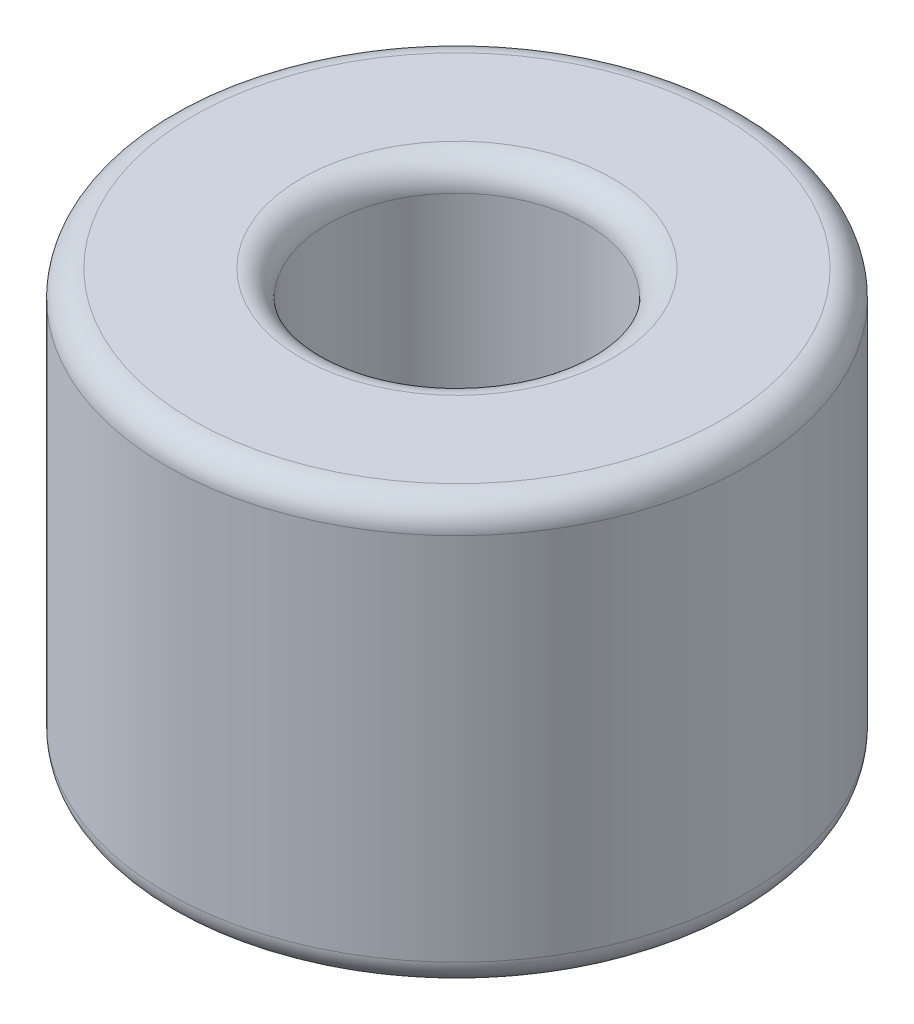
from build123d import *

# Parameters (mm, degrees)
SKETCH1_R           = 5.5
SKETCH1_R_2         = 2.45
BOSS_EXTRUDE1_DEPTH = 8
FILLET3_R           = 0.5


with BuildPart() as part:
    # Sketch1 → Boss-Extrude1 (new body)
    with BuildSketch(Plane(origin=(0, 0, 0), x_dir=(1, 0, 0), z_dir=(0, 1, 0))):
        with Locations(Location((0, 0, 0), (0, 0, 270))):
            Circle(SKETCH1_R)
        with Locations(Location((0, 0, 0), (0, 0, 270))):
            Circle(SKETCH1_R_2, mode=Mode.SUBTRACT)
    extrude(amount=BOSS_EXTRUDE1_DEPTH)

    # Fillet3
    fillet3_edges = [part.edges().sort_by_distance(p)[0] for p in [
        (0, 0, -5.5),
        (0, 8, -5.5),
        (0, 0, -2.45),
        (0, 8, -2.45),
    ]]
    fillet(fillet3_edges, radius=FILLET3_R)


solid = part.part
